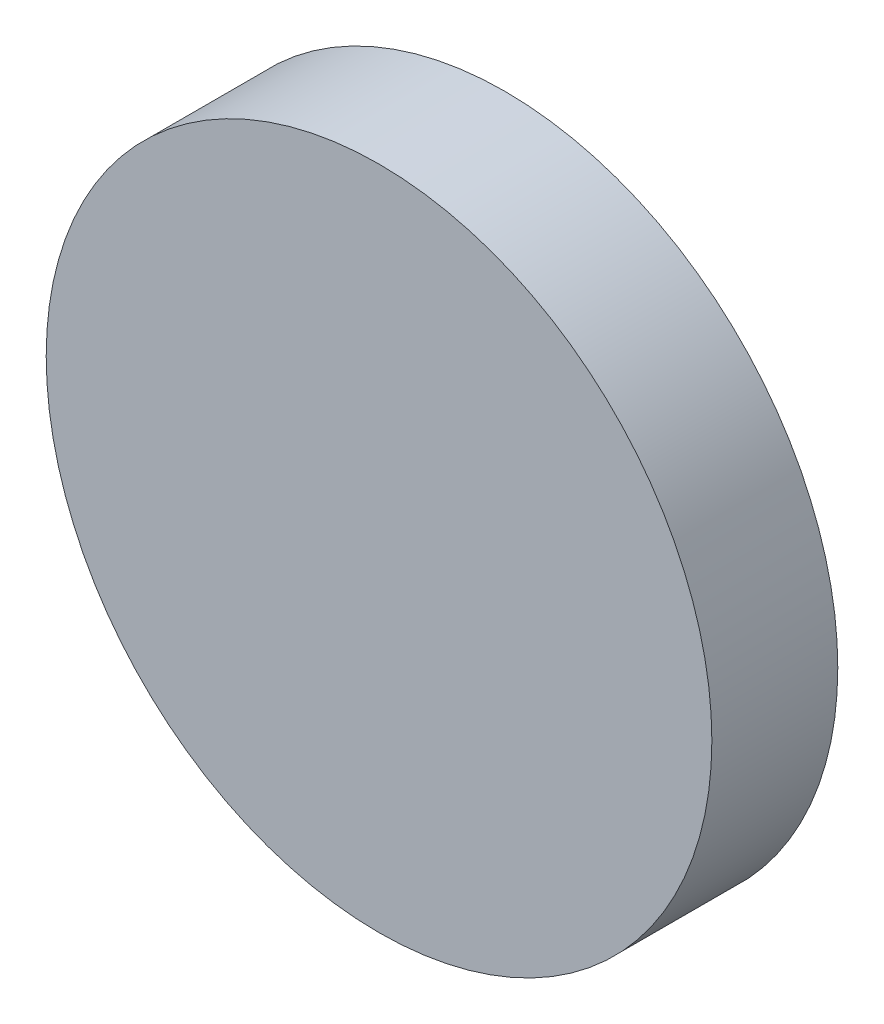
from build123d import *

# Parameters (mm, degrees)
CROQUIS1_R              = 9.25
CROQUIS1_R_2            = 3
CROQUIS1_W              = 1.5
CROQUIS1_H              = 5.80947502
SALIENTE_EXTRUIR1_DEPTH = 2.5
CROQUIS1_4_W            = 1.5
CROQUIS1_4_H            = 5.80947502
SALIENTE_EXTRUIR2_DEPTH = 5
CROQUIS1_5_R            = 9.25
CROQUIS1_5_R_2          = 3
SALIENTE_EXTRUIR3_DEPTH = 1
CORTAR_EXTRUIR1_REACH   = 16.511
CROQUIS2_R              = 1.25


with BuildPart() as part:
    # Croquis1 → Saliente-Extruir1 (new body)
    # profile 1 of 6: a face of its own
    with BuildSketch(Plane.XY):
        Circle(CROQUIS1_R)
        Circle(CROQUIS1_R_2, mode=Mode.SUBTRACT)
    # profile 2 of 6: a face of its own
    with BuildSketch(Plane.XY):
        with BuildLine():
            Line((-0.75, -2.90473751), (-0.75, 2.90473751))
            ThreePointArc((-0.75, 2.90473751), (-3, 0), (-0.75, -2.90473751))
        make_face()
    # profile 3 of 6: a face of its own
    with BuildSketch(Plane.XY):
        with BuildLine():
            ThreePointArc((3, 0), (2.371708245, 1.837117307), (0.75, 2.90473751))
            Line((0.75, 2.90473751), (0.75, -2.90473751))
            ThreePointArc((0.75, -2.90473751), (2.371708245, -1.837117307), (3, 0))
        make_face()
    # profile 4 of 6: a face of its own
    with BuildSketch(Plane.XY):
        Rectangle(CROQUIS1_W, CROQUIS1_H)
    # profile 5 of 6: a face of its own
    with BuildSketch(Plane.XY):
        with BuildLine():
            Line((0.75, -2.90473751), (-0.75, -2.90473751))
            ThreePointArc((-0.75, -2.90473751), (0, -3), (0.75, -2.90473751))
        make_face()
    # profile 6 of 6: a face of its own
    with BuildSketch(Plane.XY):
        with BuildLine():
            ThreePointArc((0.75, 2.90473751), (0, 3), (-0.75, 2.90473751))
            Line((-0.75, 2.90473751), (0.75, 2.90473751))
        make_face()
    extrude(amount=SALIENTE_EXTRUIR1_DEPTH)

    # Croquis1<4> → Saliente-Extruir2 (add)
    with BuildSketch(Plane.XY):
        Rectangle(CROQUIS1_4_W, CROQUIS1_4_H)
        with BuildLine():
            ThreePointArc((0.75, 2.90473751), (0, 3), (-0.75, 2.90473751))
            Line((-0.75, 2.90473751), (0.75, 2.90473751))
        make_face()
        with BuildLine():
            Line((0.75, -2.90473751), (-0.75, -2.90473751))
            ThreePointArc((-0.75, -2.90473751), (0, -3), (0.75, -2.90473751))
        make_face()
    extrude(amount=-SALIENTE_EXTRUIR2_DEPTH)

    # Croquis1<5> → Saliente-Extruir3 (add)
    with BuildSketch(Plane.XY):
        Circle(CROQUIS1_5_R)
        Circle(CROQUIS1_5_R_2, mode=Mode.SUBTRACT)
    extrude(amount=-SALIENTE_EXTRUIR3_DEPTH)

    # Croquis2 → Cortar-Extruir1 (cut, up to next)
    with BuildSketch(Plane(origin=(0.75, 0, 0), x_dir=(0, 0, -1), z_dir=(1, 0, 0)), mode=Mode.PRIVATE) as cortar_extruir1_sk1:
        with Locations((3.1, 0)):
            Circle(CROQUIS2_R)
    cortar_extruir1_tool1 = extrude(cortar_extruir1_sk1.sketch, amount=-CORTAR_EXTRUIR1_REACH, mode=Mode.PRIVATE) & part.part
    add(cortar_extruir1_tool1.solids().sort_by_distance((0.75, 0, -3.1))[0], mode=Mode.SUBTRACT)


solid = part.part
